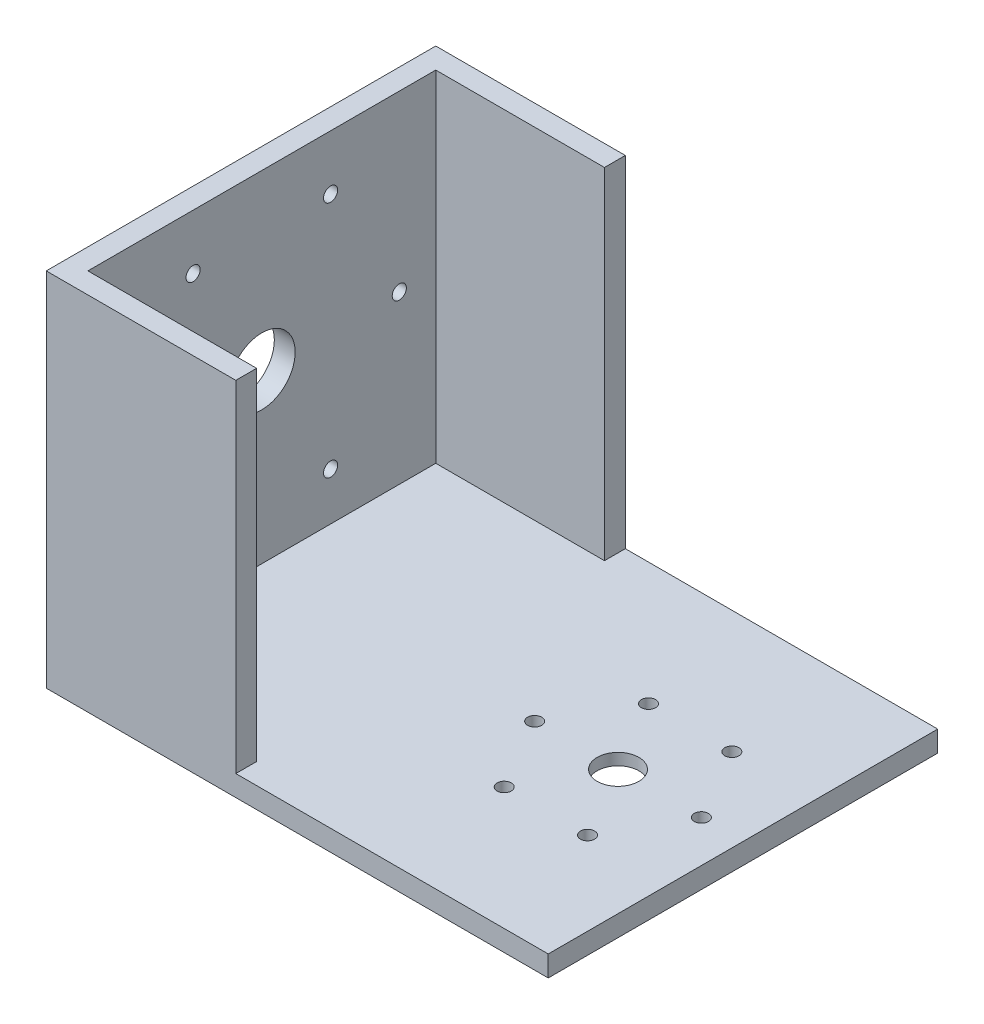
from build123d import *

# Parameters (mm, degrees)
SK_OUTPUT_PLATE_W        = 120.5
SK_OUTPUT_PLATE_H        = 93.5
SK_OUTPUT_PLATE_R        = 1.7
SK_OUTPUT_PLATE_R_2      = 5
OUTPUT_PLATE_DEPTH       = 5
SK_PITCH_PILOT_RECESS_R  = 15.15
PITCH_PILOT_RECESS_DEPTH = 2.2
SK_REAR_PLATE_W          = 93.5
SK_REAR_PLATE_H          = 86.75
SK_REAR_PLATE_R          = 8
SK_REAR_PLATE_R_2        = 1.7
REAR_PLATE_DEPTH         = 5
SK_TOP_PLATE_W           = 45.5
SK_TOP_PLATE_H           = 86.75
TOP_PLATE_DEPTH          = 5
SK_BOTTOM_PLATE_W        = 45.5
SK_BOTTOM_PLATE_H        = 86.75
BOTTOM_PLATE_DEPTH       = 5


with BuildPart() as part:
    # SK_Output_Plate → Output_Plate (new body)
    with BuildSketch(Plane(origin=(0, 0, 0), x_dir=(1, 0, 0), z_dir=(0, 1, 0))):
        with Locations((-30.25, 0)):
            Rectangle(SK_OUTPUT_PLATE_W, SK_OUTPUT_PLATE_H)
        with Locations(Location((20, 0, 0), (0, 0, 270))):
            Circle(SK_OUTPUT_PLATE_R, mode=Mode.SUBTRACT)
        with Locations(Location((10, 17.320508076, 0), (0, 0, 270))):
            Circle(SK_OUTPUT_PLATE_R, mode=Mode.SUBTRACT)
        with Locations(Location((-10, 17.320508076, 0), (0, 0, 270))):
            Circle(SK_OUTPUT_PLATE_R, mode=Mode.SUBTRACT)
        with Locations(Location((-20, 0, 0), (0, 0, 270))):
            Circle(SK_OUTPUT_PLATE_R, mode=Mode.SUBTRACT)
        with Locations(Location((-10, -17.320508076, 0), (0, 0, 270))):
            Circle(SK_OUTPUT_PLATE_R, mode=Mode.SUBTRACT)
        with Locations(Location((10, -17.320508076, 0), (0, 0, 270))):
            Circle(SK_OUTPUT_PLATE_R, mode=Mode.SUBTRACT)
        with Locations(Location((0, 0, 0), (0, 0, 270))):
            Circle(SK_OUTPUT_PLATE_R_2, mode=Mode.SUBTRACT)
    extrude(amount=OUTPUT_PLATE_DEPTH)

    # SK_Pitch_Pilot_Recess → Pitch_Pilot_Recess (cut)
    with BuildSketch(Plane(origin=(0, 0, 0), x_dir=(1, 0, 0), z_dir=(0, 1, 0))):
        with Locations(Location((0, 0, 0), (0, 0, 270))):
            Circle(SK_PITCH_PILOT_RECESS_R)
    extrude(amount=PITCH_PILOT_RECESS_DEPTH, mode=Mode.SUBTRACT)

    # SK_Rear_Plate → Rear_Plate (add)
    with BuildSketch(Plane(origin=(-90.5, 0, 0), x_dir=(0, 0, -1), z_dir=(1, 0, 0))):
        with Locations((0, 43.375)):
            Rectangle(SK_REAR_PLATE_W, SK_REAR_PLATE_H)
        with Locations((0, 45)):
            Circle(SK_REAR_PLATE_R, mode=Mode.SUBTRACT)
        with Locations((33, 45)):
            Circle(SK_REAR_PLATE_R_2, mode=Mode.SUBTRACT)
        with Locations((16.5, 73.578838325)):
            Circle(SK_REAR_PLATE_R_2, mode=Mode.SUBTRACT)
        with Locations((-16.5, 73.578838325)):
            Circle(SK_REAR_PLATE_R_2, mode=Mode.SUBTRACT)
        with Locations((-33, 45)):
            Circle(SK_REAR_PLATE_R_2, mode=Mode.SUBTRACT)
        with Locations((-16.5, 16.421161675)):
            Circle(SK_REAR_PLATE_R_2, mode=Mode.SUBTRACT)
        with Locations((16.5, 16.421161675)):
            Circle(SK_REAR_PLATE_R_2, mode=Mode.SUBTRACT)
    extrude(amount=REAR_PLATE_DEPTH)

    # SK_Top_Plate → Top_Plate (add)
    with BuildSketch(Plane.XY.offset(41.75)):
        with Locations((-67.75, 43.375)):
            Rectangle(SK_TOP_PLATE_W, SK_TOP_PLATE_H)
    extrude(amount=TOP_PLATE_DEPTH)

    # SK_Bottom_Plate → Bottom_Plate (add)
    with BuildSketch(Plane.XY.offset(-46.75)):
        with Locations((-67.75, 43.375)):
            Rectangle(SK_BOTTOM_PLATE_W, SK_BOTTOM_PLATE_H)
    extrude(amount=BOTTOM_PLATE_DEPTH)


solid = part.part
